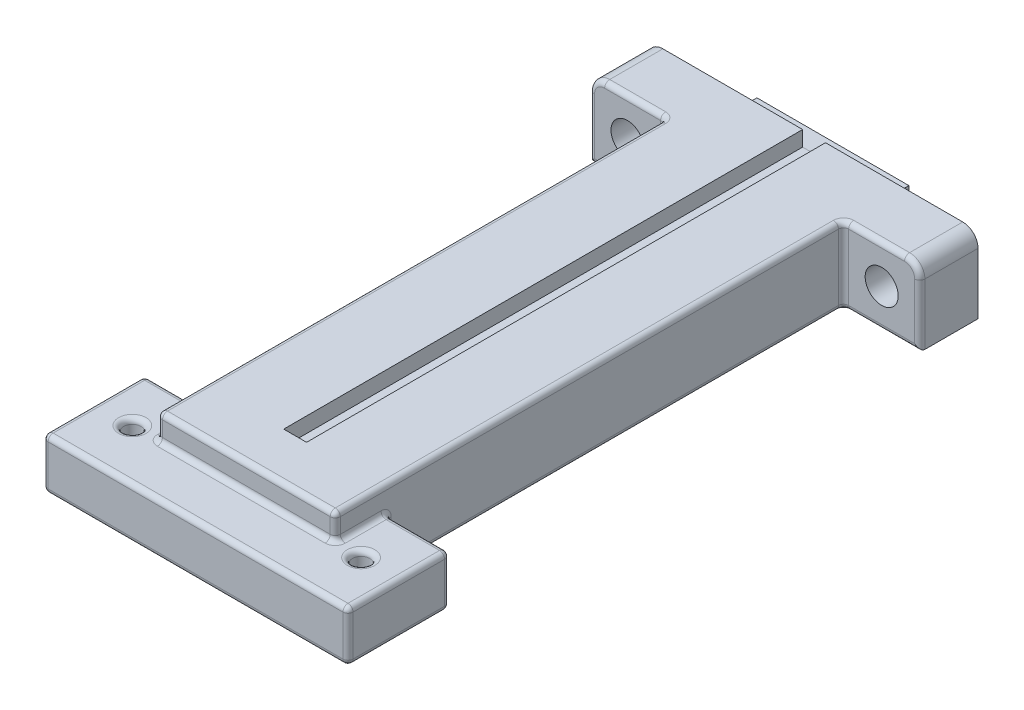
from build123d import *

# Parameters (mm, degrees)
SKETCH1_W           = 65
SKETCH1_H           = 15
SKETCH1_R           = 3.25
BOSS_EXTRUDE1_DEPTH = 11.45
SKETCH2_W           = 35
SKETCH2_H           = 15
BOSS_EXTRUDE2_DEPTH = 100
SKETCH3_W           = 60
SKETCH3_H           = 20
BOSS_EXTRUDE3_DEPTH = 10
SKETCH4_R           = 1.7
CUT_EXTRUDE1_DEPTH  = 31.45
SKETCH5_W           = 29.9
SKETCH5_H           = 7.9
BOSS_EXTRUDE4_DEPTH = 4
SKETCH6_W           = 4.5
SKETCH6_H           = 102.097133978
CUT_EXTRUDE2_DEPTH  = 3
FILLET1_R           = 3
FILLET2_R           = 1


with BuildPart() as part:
    # Sketch1 → Boss-Extrude1 (new body)
    with BuildSketch(Plane.XY):
        with Locations((32.5, 7.5)):
            Rectangle(SKETCH1_W, SKETCH1_H)
        with Locations((7.5, 7.5)):
            Circle(SKETCH1_R, mode=Mode.SUBTRACT)
        with Locations((57.5, 7.5)):
            Circle(SKETCH1_R, mode=Mode.SUBTRACT)
    extrude(amount=BOSS_EXTRUDE1_DEPTH)

    # Sketch2 → Boss-Extrude2 (add)
    with BuildSketch(Plane.XY.offset(11.45)):
        with Locations((32.5, 7.5)):
            Rectangle(SKETCH2_W, SKETCH2_H)
    extrude(amount=BOSS_EXTRUDE2_DEPTH)

    # Sketch3 → Boss-Extrude3 (add)
    with BuildSketch(Plane(origin=(0, 0, 0), x_dir=(-1, 0, 0), z_dir=(0, -1, 0))):
        with Locations((-32.5, -111.45)):
            Rectangle(SKETCH3_W, SKETCH3_H)
    extrude(amount=-BOSS_EXTRUDE3_DEPTH)

    # Sketch4 → Cut-Extrude1 (cut)
    with BuildSketch(Plane(origin=(0, 15, 0), x_dir=(1, 0, 0), z_dir=(0, 1, 0))):
        with Locations(Location((10, -111.374859721, 0), (0, 0, 270))):
            Circle(SKETCH4_R)
        with Locations(Location((55, -111.374859721, 0), (0, 0, 270))):
            Circle(SKETCH4_R)
    extrude(amount=-CUT_EXTRUDE1_DEPTH, mode=Mode.SUBTRACT)

    # Sketch5 → Boss-Extrude4 (add)
    with BuildSketch(Plane(origin=(0, 0, 0), x_dir=(-1, 0, 0), z_dir=(0, 0, -1))):
        with Locations((-32.45, 7.95)):
            Rectangle(SKETCH5_W, SKETCH5_H)
    extrude(amount=BOSS_EXTRUDE4_DEPTH)

    # Sketch6 → Cut-Extrude2 (cut)
    with BuildSketch(Plane(origin=(0, 15, 0), x_dir=(1, 0, 0), z_dir=(0, 1, 0))):
        with Locations((32.75, -51.048566989)):
            Rectangle(SKETCH6_W, SKETCH6_H)
    extrude(amount=-CUT_EXTRUDE2_DEPTH, mode=Mode.SUBTRACT)

    # Fillet1
    fillet1_edges = [part.edges().sort_by_distance(p)[0] for p in [
        (0, 15, 5.725),
        (65, 15, 5.725),
    ]]
    fillet(fillet1_edges, radius=FILLET1_R)

    # Fillet2
    fillet2_edges = [part.edges().sort_by_distance(p)[0] for p in [
        (56, 15, 11.45),
        (64.121320344, 14.121320344, 11.45),
        (0, 6, 11.45),
        (0.878679656, 14.121320344, 11.45),
        (65, 6, 11.45),
        (57.5, 0, 11.45),
        (9, 15, 11.45),
        (15, 7.5, 11.45),
        (15, 15, 61.45),
        (50, 7.5, 11.45),
        (50, 15, 61.45),
        (15, 12.5, 111.45),
        (32.5, 15, 111.45),
        (50, 12.5, 111.45),
        (32.5, 10, 111.45),
        (50, 0, 56.45),
        (50, 5, 101.45),
        (15, 0, 56.45),
        (8.75, 10, 101.45),
        (56.25, 10, 101.45),
        (62.5, 5, 101.45),
        (8.75, 0, 101.45),
        (56.25, 0, 101.45),
        (62.5, 0, 111.45),
        (32.5, 0, 121.45),
        (2.5, 0, 111.45),
        (62.5, 10, 111.45),
        (62.5, 5, 121.45),
        (15, 5, 101.45),
        (2.5, 10, 111.45),
        (2.5, 5, 101.45),
        (32.5, 10, 121.45),
        (2.5, 5, 121.45),
        (15, 10, 106.45),
        (50, 10, 106.45),
        (10, 10, 109.674859721),
        (55, 10, 109.674859721),
        (7.5, 0, 11.45),
    ]]
    fillet(fillet2_edges, radius=FILLET2_R)


solid = part.part
